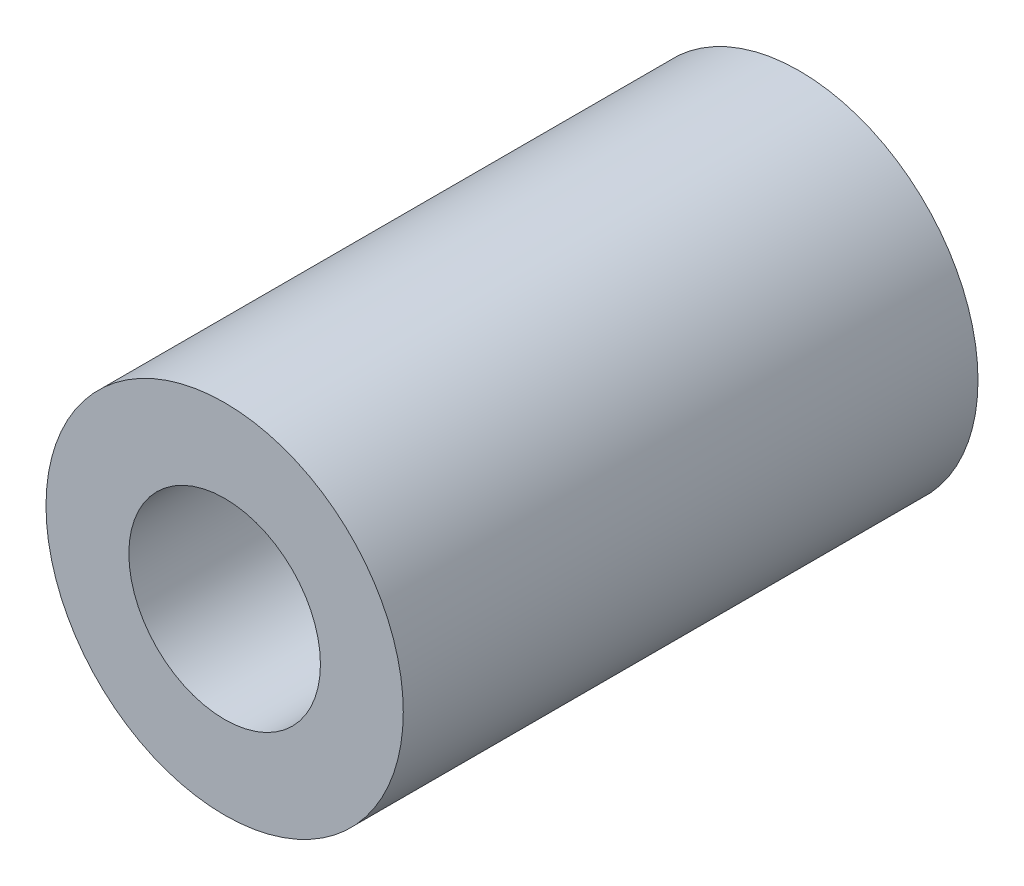
from build123d import *

# Parameters (mm, degrees)
SKETCH1_R           = 7.46
BOSS_EXTRUDE1_DEPTH = 24
SKETCH2_R           = 4
CUT_EXTRUDE1_DEPTH  = 24


with BuildPart() as part:
    # Sketch1 → Boss-Extrude1 (new body)
    with BuildSketch(Plane.XY):
        Circle(SKETCH1_R)
    extrude(amount=BOSS_EXTRUDE1_DEPTH)

    # Sketch2 → Cut-Extrude1 (cut)
    with BuildSketch(Plane.XY):
        Circle(SKETCH2_R)
    extrude(amount=CUT_EXTRUDE1_DEPTH, mode=Mode.SUBTRACT)


solid = part.part
